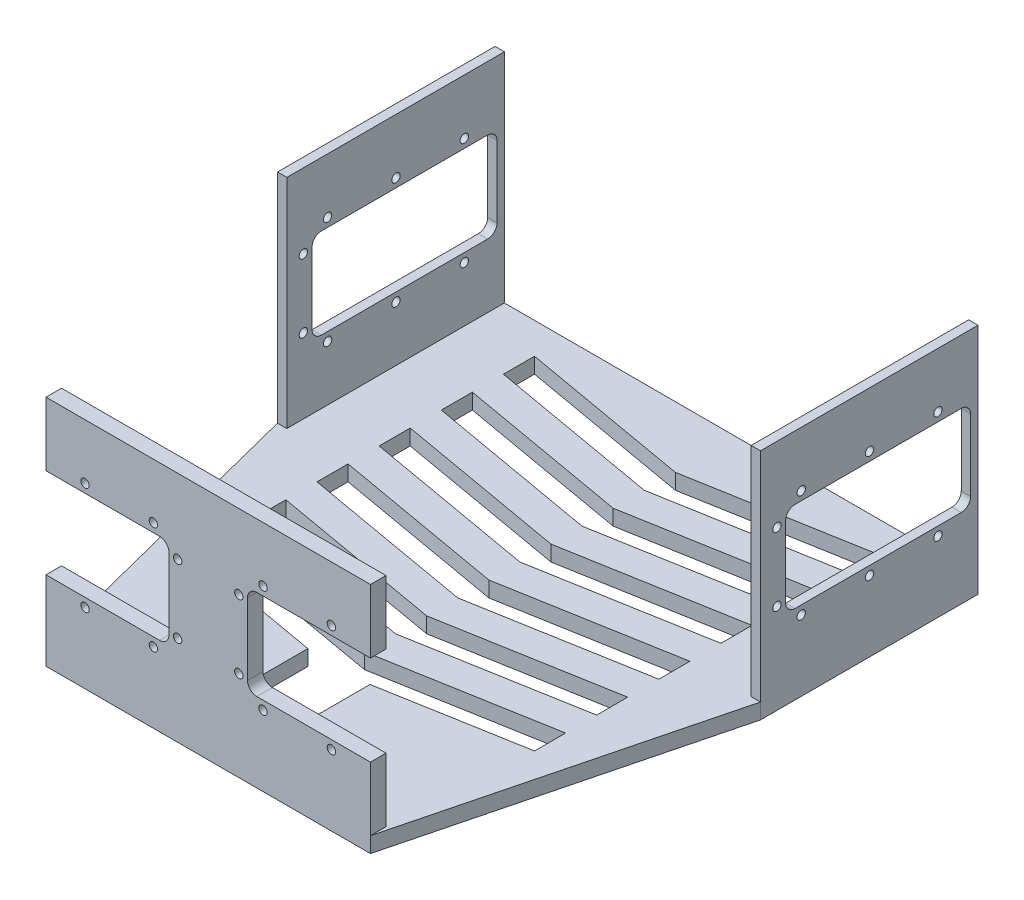
from build123d import *

# Parameters (mm, degrees)
BOSS_EXTRUDE1_DEPTH     = 3
SKETCH4_W               = 70
SKETCH4_H               = 70
BOSS_EXTRUDE3_DEPTH     = 3
SKETCH5_W               = 70
SKETCH5_H               = 70
BOSS_EXTRUDE4_DEPTH     = 3
SKETCH7_W               = 104.4
SKETCH7_H               = 70
BOSS_EXTRUDE5_DEPTH     = 5
BOSS_EXTRUDE13_DEPTH    = 2
CUT_EXTRUDE1_DEPTH      = 242.615727965
CUT_EXTRUDE1_DEPTH_BACK = 242.615727965
SKETCH26_R              = 1.35
CUT_EXTRUDE3_DEPTH      = 240.697225683
CUT_EXTRUDE3_DEPTH_BACK = 240.697225683
CUT_EXTRUDE4_DEPTH      = 223.324110253
CUT_EXTRUDE4_DEPTH_BACK = 223.324110253
SKETCH31_R              = 1.35
CUT_EXTRUDE6_DEPTH      = 5


with BuildPart() as part:
    # Sketch1 → Boss-Extrude1 (new body)
    with BuildSketch(Plane(origin=(0, 0, 0), x_dir=(1, 0, 0), z_dir=(0, 1, 0))):
        Polygon((0, 0), (104.4, 0), (129.9, 100), (129.9, 170), (-25.5, 170), (-25.5, 100), align=None)
    extrude(amount=BOSS_EXTRUDE1_DEPTH)

    # Sketch4 → Boss-Extrude3 (add)
    with BuildSketch(Plane.ZY.offset(25.5)):
        with Locations((-135, 38)):
            Rectangle(SKETCH4_W, SKETCH4_H)
    extrude(amount=-BOSS_EXTRUDE3_DEPTH)

    # Sketch5 → Boss-Extrude4 (add)
    with BuildSketch(Plane(origin=(129.9, 0, 0), x_dir=(0, 0, -1), z_dir=(1, 0, 0))):
        with Locations((135, 38)):
            Rectangle(SKETCH5_W, SKETCH5_H)
    extrude(amount=-BOSS_EXTRUDE4_DEPTH)

    # Sketch7 → Boss-Extrude5 (add)
    with BuildSketch(Plane.XY):
        with Locations((52.2, 38)):
            Rectangle(SKETCH7_W, SKETCH7_H)
    extrude(amount=-BOSS_EXTRUDE5_DEPTH)

    # Sketch22 → Boss-Extrude13 (add)
    with BuildSketch(Plane.XZ):
        Polygon((129.9, -170), (-25.5, -170), (-25.5, -100), (0, 0), (104.4, 0), (129.9, -100), align=None)
    extrude(amount=BOSS_EXTRUDE13_DEPTH)

    # Sketch26 → Cut-Extrude1 (cut, two sides: drawn at the far end of the back side and taken through both)
    with BuildSketch(Plane.ZY.offset(25.5).offset(-CUT_EXTRUDE1_DEPTH_BACK)):
        with Locations((-157.113745641, 20.7)):
            Circle(SKETCH26_R)
        with Locations((-113.113745641, 20.7)):
            Circle(SKETCH26_R)
        with Locations((-105.313745641, 27)):
            Circle(SKETCH26_R)
        with Locations((-105.313745641, 49)):
            Circle(SKETCH26_R)
        with Locations((-113.113745641, 55.3)):
            Circle(SKETCH26_R)
        with Locations((-135.113745641, 55.3)):
            Circle(SKETCH26_R)
        with Locations((-157.113745641, 55.3)):
            Circle(SKETCH26_R)
        with Locations((-135.113745641, 20.7)):
            Circle(SKETCH26_R)
    extrude(amount=CUT_EXTRUDE1_DEPTH + CUT_EXTRUDE1_DEPTH_BACK, mode=Mode.SUBTRACT)

    # Sketch28 → Cut-Extrude3 (cut, two sides: drawn at the far end of the back side and taken through both)
    with BuildSketch(Plane(origin=(-22.5, 0, 0), x_dir=(0, 0, -1), z_dir=(1, 0, 0)).offset(-CUT_EXTRUDE3_DEPTH_BACK)):
        with BuildLine():
            Line((167.613745641, 49.5), (167.613745641, 26.5))
            ThreePointArc((167.613745641, 26.5), (166.735065984, 24.378679656), (164.613745641, 23.5))
            Line((164.613745641, 23.5), (111.113745641, 23.5))
            ThreePointArc((111.113745641, 23.5), (108.992425297, 24.378679656), (108.113745641, 26.5))
            Line((108.113745641, 26.5), (108.113745641, 49.5))
            ThreePointArc((108.113745641, 49.5), (108.992425297, 51.621320344), (111.113745641, 52.5))
            Line((111.113745641, 52.5), (164.613745641, 52.5))
            ThreePointArc((164.613745641, 52.5), (166.735065984, 51.621320344), (167.613745641, 49.5))
        make_face()
    extrude(amount=CUT_EXTRUDE3_DEPTH + CUT_EXTRUDE3_DEPTH_BACK, mode=Mode.SUBTRACT)

    # Sketch31 → Cut-Extrude4 (cut, two sides: drawn at the far end of the back side and taken through both)
    with BuildSketch(Plane(origin=(0, 0, -5), x_dir=(-1, 0, 0), z_dir=(0, 0, -1)).offset(-CUT_EXTRUDE4_DEPTH_BACK)):
        with BuildLine():
            Line((0, 52.5), (-36.563880863, 52.5))
            ThreePointArc((-36.563880863, 52.5), (-38.685201207, 51.621320344), (-39.563880863, 49.5))
            Line((-39.563880863, 49.5), (-39.563880863, 26.5))
            ThreePointArc((-39.563880863, 26.5), (-38.685201207, 24.378679656), (-36.563880863, 23.5))
            Line((-36.563880863, 23.5), (0, 23.5))
            Line((0, 23.5), (0, 25.098503624))
            ThreePointArc((0, 25.098503624), (-8.563880863, 38), (0, 50.901496376))
            Line((0, 50.901496376), (0, 52.5))
        make_face()
        with BuildLine():
            Line((0, 25.098503624), (0, 50.901496376))
            ThreePointArc((0, 50.901496376), (-8.563880863, 38), (0, 25.098503624))
        make_face()
        with BuildLine():
            ThreePointArc((-67.836119137, 23.5), (-65.714798793, 24.378679656), (-64.836119137, 26.5))
            Line((-64.836119137, 26.5), (-64.836119137, 49.5))
            ThreePointArc((-64.836119137, 49.5), (-65.714798793, 51.621320344), (-67.836119137, 52.5))
            Line((-67.836119137, 52.5), (-104.4, 52.5))
            Line((-104.4, 52.5), (-104.4, 50.901496376))
            ThreePointArc((-104.4, 50.901496376), (-95.836119137, 38), (-104.4, 25.098503624))
            Line((-104.4, 25.098503624), (-104.4, 23.5))
            Line((-104.4, 23.5), (-67.836119137, 23.5))
        make_face()
        with BuildLine():
            Line((-104.4, 50.901496376), (-104.4, 25.098503624))
            ThreePointArc((-104.4, 25.098503624), (-95.836119137, 38), (-104.4, 50.901496376))
        make_face()
        with Locations(Location((-91.836119137, 20.7, 0), (0, 0, 180))):
            Circle(SKETCH31_R)
        with Locations(Location((-69.836119137, 20.7, 0), (0, 0, 180))):
            Circle(SKETCH31_R)
        with Locations(Location((-62.036119137, 27, 0), (0, 0, 180))):
            Circle(SKETCH31_R)
        with Locations(Location((-62.036119137, 49, 0), (0, 0, 180))):
            Circle(SKETCH31_R)
        with Locations(Location((-69.836119137, 55.3, 0), (0, 0, 180))):
            Circle(SKETCH31_R)
        with Locations(Location((-91.836119137, 55.3, 0), (0, 0, 180))):
            Circle(SKETCH31_R)
        with Locations((-34.563880863, 55.3)):
            Circle(SKETCH31_R)
        with Locations((-42.363880863, 49)):
            Circle(SKETCH31_R)
        with Locations((-42.363880863, 27)):
            Circle(SKETCH31_R)
        with Locations((-34.563880863, 20.7)):
            Circle(SKETCH31_R)
        with Locations((-12.563880863, 20.7)):
            Circle(SKETCH31_R)
        with Locations((-12.563880863, 55.3)):
            Circle(SKETCH31_R)
    extrude(amount=CUT_EXTRUDE4_DEPTH + CUT_EXTRUDE4_DEPTH_BACK, mode=Mode.SUBTRACT)

    # Sketch32 → Cut-Extrude6 (cut)
    with BuildSketch(Plane(origin=(0, -2, 0), x_dir=(-1, 0, 0), z_dir=(0, -1, 0))):
        Polygon((-62.2, 142.065285868), (-62.2, 152.065285868), (-107.2, 160), (-107.2, 150), align=None)
        Polygon((-52.2, 140.302016061), (-52.2, 150.302016061), (-62.2, 152.065285868), (-62.2, 142.065285868), align=None)
        Polygon((-42.2, 152.065285868), (-52.2, 150.302016061), (-52.2, 140.302016061), (-42.2, 142.065285868), align=None)
        Polygon((2.8, 160), (-42.2, 152.065285868), (-42.2, 142.065285868), (2.8, 150), align=None)
        Polygon((-62.2, 122.065285868), (-62.2, 132.065285868), (-107.2, 140), (-107.2, 130), align=None)
        Polygon((-52.2, 120.302016061), (-52.2, 130.302016061), (-62.2, 132.065285868), (-62.2, 122.065285868), align=None)
        Polygon((-42.2, 132.065285868), (-52.2, 130.302016061), (-52.2, 120.302016061), (-42.2, 122.065285868), align=None)
        Polygon((2.8, 140), (-42.2, 132.065285868), (-42.2, 122.065285868), (2.8, 130), align=None)
        Polygon((-62.2, 102.065285868), (-62.2, 112.065285868), (-107.2, 120), (-107.2, 110), align=None)
        Polygon((-52.2, 100.302016061), (-52.2, 110.302016061), (-62.2, 112.065285868), (-62.2, 102.065285868), align=None)
        Polygon((-42.2, 112.065285868), (-52.2, 110.302016061), (-52.2, 100.302016061), (-42.2, 102.065285868), align=None)
        Polygon((2.8, 120), (-42.2, 112.065285868), (-42.2, 102.065285868), (2.8, 110), align=None)
        Polygon((-62.2, 82.065285868), (-62.2, 92.065285868), (-107.2, 100), (-107.2, 90), align=None)
        Polygon((-52.2, 80.302016061), (-52.2, 90.302016061), (-62.2, 92.065285868), (-62.2, 82.065285868), align=None)
        Polygon((-42.2, 92.065285868), (-52.2, 90.302016061), (-52.2, 80.302016061), (-42.2, 82.065285868), align=None)
        Polygon((2.8, 100), (-42.2, 92.065285868), (-42.2, 82.065285868), (2.8, 90), align=None)
        Polygon((-62.2, 62.065285868), (-62.2, 72.065285868), (-107.2, 80), (-107.2, 70), align=None)
        Polygon((-52.2, 60.302016061), (-52.2, 70.302016061), (-62.2, 72.065285868), (-62.2, 62.065285868), align=None)
        Polygon((-42.2, 72.065285868), (-52.2, 70.302016061), (-52.2, 60.302016061), (-42.2, 62.065285868), align=None)
        Polygon((2.8, 80), (-42.2, 72.065285868), (-42.2, 62.065285868), (2.8, 70), align=None)
        Polygon((-62.2, 42.065285868), (-62.2, 52.065285868), (-107.2, 60), (-107.2, 50), align=None)
        Polygon((-52.2, 40.302016061), (-52.2, 50.302016061), (-62.2, 52.065285868), (-62.2, 42.065285868), align=None)
        Polygon((-42.2, 52.065285868), (-52.2, 50.302016061), (-52.2, 40.302016061), (-42.2, 42.065285868), align=None)
        Polygon((2.8, 60), (-42.2, 52.065285868), (-42.2, 42.065285868), (2.8, 50), align=None)
        Polygon((-52.2, 30.302016061), (-52.2, 40.302016061), (-62.2, 42.065285868), (-62.2, 32.065285868), align=None)
        Polygon((-42.2, 42.065285868), (-52.2, 40.302016061), (-52.2, 30.302016061), (-42.2, 32.065285868), align=None)
        Polygon((-42.2, 32.065285868), (-52.2, 30.302016061), (-52.2, 20.302016061), (-42.2, 22.065285868), align=None)
        Polygon((-52.2, 20.302016061), (-52.2, 30.302016061), (-62.2, 32.065285868), (-62.2, 22.065285868), align=None)
    extrude(amount=-CUT_EXTRUDE6_DEPTH, mode=Mode.SUBTRACT)


solid = part.part
